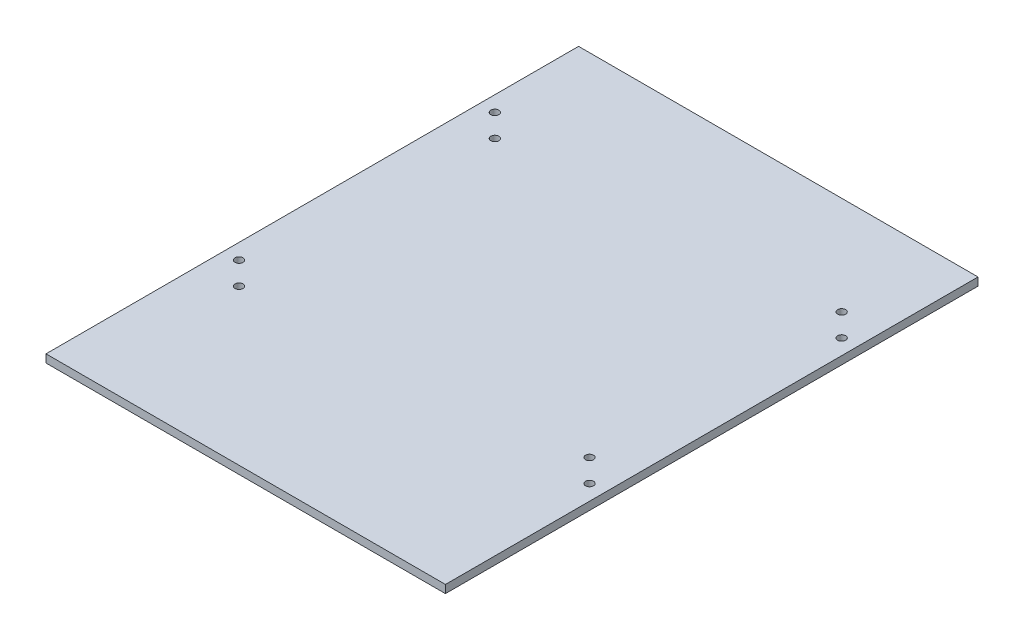
from build123d import *

# Parameters (mm, degrees)
SKETCH1_W           = 150
SKETCH1_H           = 200
SKETCH1_R           = 1.5
BOSS_EXTRUDE1_DEPTH = 3


with BuildPart() as part:
    # Sketch1 → Boss-Extrude1 (new body)
    with BuildSketch(Plane(origin=(0, 0, 0), x_dir=(1, 0, 0), z_dir=(0, 1, 0))):
        Rectangle(SKETCH1_W, SKETCH1_H)
        with Locations(Location((-69.242640687, 62.79605759, 0), (0, 0, 270))):
            Circle(SKETCH1_R, mode=Mode.SUBTRACT)
        with Locations(Location((-60.757359313, 54.310776216, 0), (0, 0, 270))):
            Circle(SKETCH1_R, mode=Mode.SUBTRACT)
        with Locations(Location((60.757359313, 63.034810844, 0), (0, 0, 270))):
            Circle(SKETCH1_R, mode=Mode.SUBTRACT)
        with Locations(Location((69.242640687, 54.54952947, 0), (0, 0, 270))):
            Circle(SKETCH1_R, mode=Mode.SUBTRACT)
        with Locations(Location((-69.242640687, -33.274226936, 0), (0, 0, 270))):
            Circle(SKETCH1_R, mode=Mode.SUBTRACT)
        with Locations(Location((-60.757359313, -41.75950831, 0), (0, 0, 270))):
            Circle(SKETCH1_R, mode=Mode.SUBTRACT)
        with Locations(Location((60.757359313, -31.641853854, 0), (0, 0, 270))):
            Circle(SKETCH1_R, mode=Mode.SUBTRACT)
        with Locations(Location((69.242640687, -40.127135228, 0), (0, 0, 270))):
            Circle(SKETCH1_R, mode=Mode.SUBTRACT)
    extrude(amount=BOSS_EXTRUDE1_DEPTH)


solid = part.part
